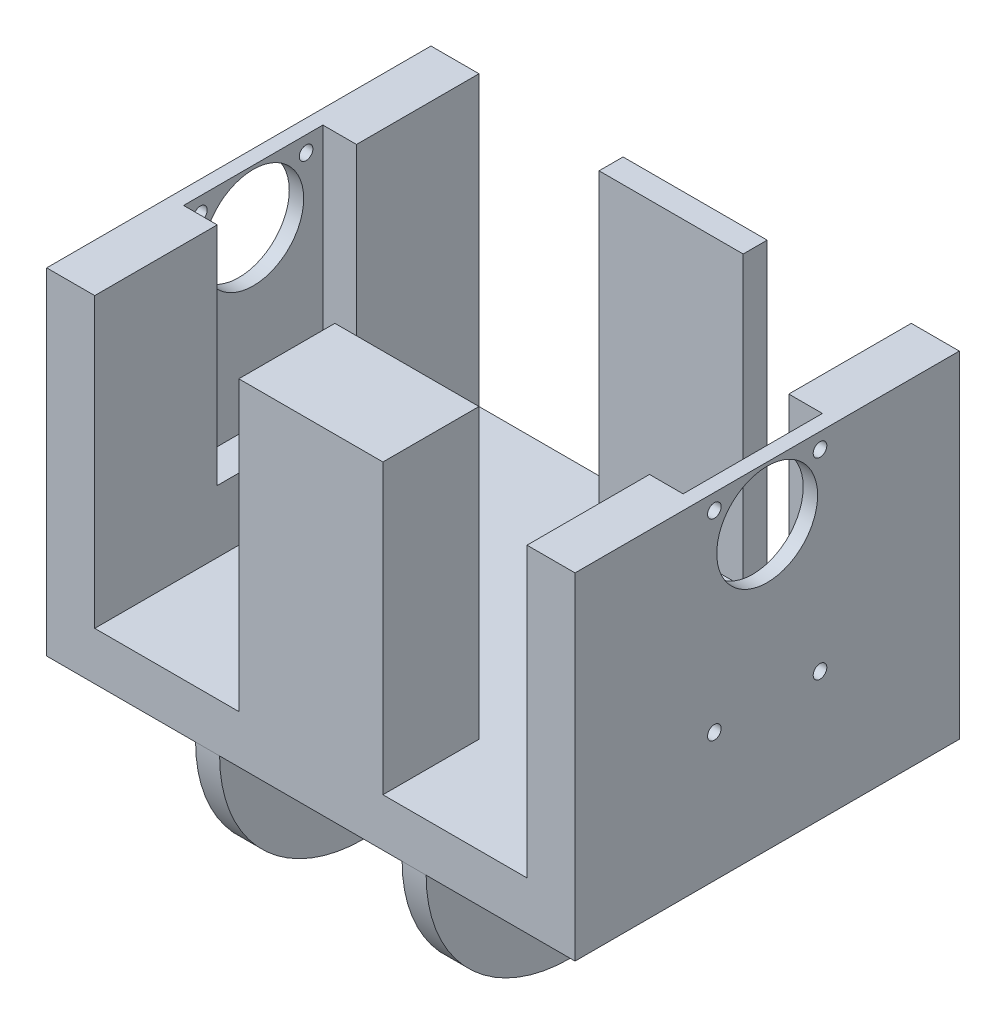
from build123d import *

# Parameters (mm, degrees)
SKETCH1_W           = 5
SKETCH1_H           = 30
BOSS_EXTRUDE1_DEPTH = 80
SKETCH2_R           = 1.2
SKETCH2_R_2         = 4.4
CUT_EXTRUDE1_DEPTH  = 80
CUT_EXTRUDE3_DEPTH  = 60
FILLET1_R           = 30
SKETCH6_R           = 10.5
SKETCH6_R_2         = 1.41450308
CUT_EXTRUDE4_DEPTH  = 151.748134317
SKETCH8_W           = 7
SKETCH8_H           = 29
CUT_EXTRUDE5_DEPTH  = 47


with BuildPart() as part:
    # Sketch1 → Boss-Extrude1 (new body)
    with BuildSketch(Plane.XY):
        Polygon((55, 35), (-55, 35), (-55, -35), (-24, -35), (-19, -35), (19, -35), (24, -35), (55, -35), align=None)
        with Locations((-21.5, -50)):
            Rectangle(SKETCH1_W, SKETCH1_H)
        with Locations((21.5, -50)):
            Rectangle(SKETCH1_W, SKETCH1_H)
    extrude(amount=BOSS_EXTRUDE1_DEPTH)

    # Sketch2 → Cut-Extrude1 (cut)
    with BuildSketch(Plane(origin=(24, 0, 0), x_dir=(0, 0, -1), z_dir=(1, 0, 0))):
        with Locations(Location((-40, -45, 0), (0, 0, 90))):
            Circle(SKETCH2_R)
        with Locations(Location((-32, -53, 0), (0, 0, 90))):
            Circle(SKETCH2_R)
        with Locations(Location((-40, -61, 0), (0, 0, 90))):
            Circle(SKETCH2_R)
        with Locations(Location((-48, -53, 0), (0, 0, 90))):
            Circle(SKETCH2_R)
        with Locations(Location((-40, -53, 0), (0, 0, 90))):
            Circle(SKETCH2_R_2)
    extrude(amount=-CUT_EXTRUDE1_DEPTH, mode=Mode.SUBTRACT)

    # Sketch4 → Cut-Extrude3 (cut)
    with BuildSketch(Plane(origin=(0, 35, 0), x_dir=(1, 0, 0), z_dir=(0, 1, 0))):
        Polygon((-45, 0), (-45, -80), (-15, -80), (-15, -60), (15, -60), (15, -80), (45, -80), (45, 0), (15, 0), (15, -5), (-15, -5), (-15, 0), align=None)
    extrude(amount=-CUT_EXTRUDE3_DEPTH, mode=Mode.SUBTRACT)

    # Fillet1
    fillet1_edges = [part.edges().sort_by_distance(p)[0] for p in [
        (-21.5, -65, 0),
        (-21.5, -65, 80),
        (21.5, -65, 0),
        (21.5, -65, 80),
    ]]
    fillet(fillet1_edges, radius=FILLET1_R)

    # Sketch6 → Cut-Extrude4 (cut, through all)
    with BuildSketch(Plane(origin=(55, 0, 0), x_dir=(0, 0, -1), z_dir=(1, 0, 0))):
        with Locations((-40, 23.75)):
            Circle(SKETCH6_R)
        with Locations((-51, 31.75)):
            Circle(SKETCH6_R_2)
        with Locations((-29, 31.75)):
            Circle(SKETCH6_R_2)
        with Locations((-51, -8.25)):
            Circle(SKETCH6_R_2)
        with Locations((-29, -8.25)):
            Circle(SKETCH6_R_2)
    extrude(amount=-CUT_EXTRUDE4_DEPTH, mode=Mode.SUBTRACT)

    # Sketch8 → Cut-Extrude5 (cut)
    with BuildSketch(Plane(origin=(0, 35, 0), x_dir=(1, 0, 0), z_dir=(0, 1, 0))):
        with Locations((-48.5, -40)):
            Rectangle(SKETCH8_W, SKETCH8_H)
        with Locations((48.5, -40)):
            Rectangle(SKETCH8_W, SKETCH8_H)
    extrude(amount=-CUT_EXTRUDE5_DEPTH, mode=Mode.SUBTRACT)


solid = part.part
